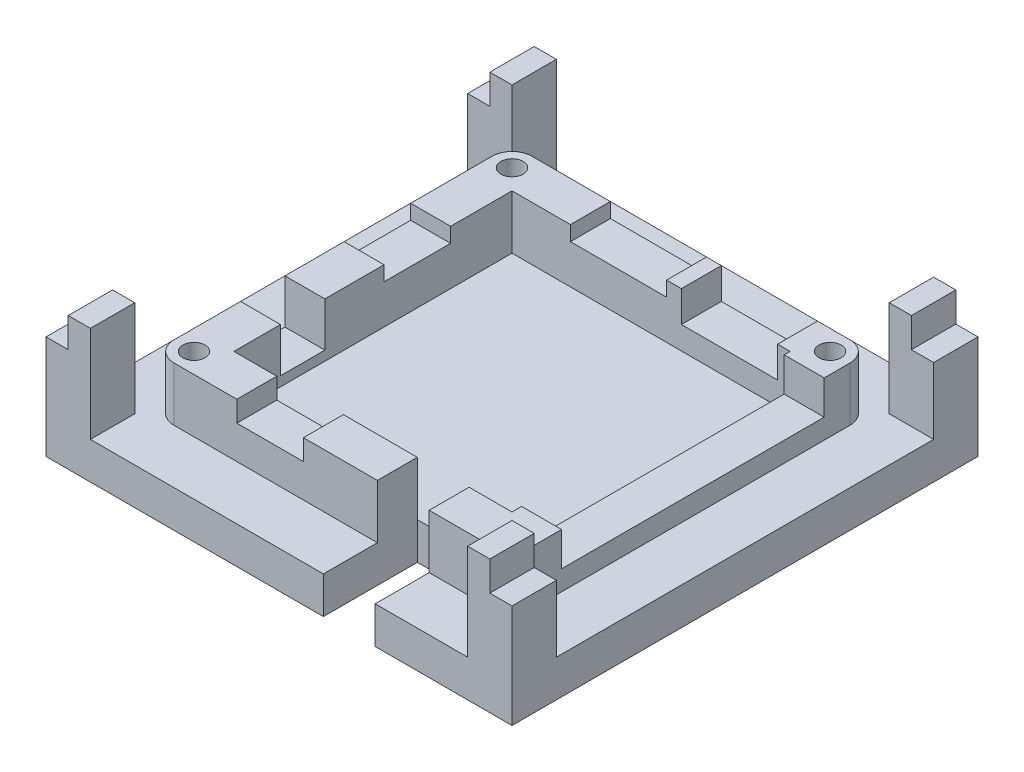
from build123d import *

# Parameters (mm, degrees)
SKETCH1_W           = 63
SKETCH1_H           = 63
BOSS_EXTRUDE1_DEPTH = 5
SKETCH2_W           = 6
SKETCH2_H           = 6
BOSS_EXTRUDE2_DEPTH = 13
SKETCH3_R           = 1.5
CUT_EXTRUDE1_DEPTH  = 5
BOSS_EXTRUDE3_START = 7.3
SKETCH4_R           = 2.7
SKETCH4_R_2         = 1.5
BOSS_EXTRUDE3_DEPTH = 7.3
BOSS_EXTRUDE4_START = 7.3
BOSS_EXTRUDE4_DEPTH = 7.3
SKETCH6_W           = 9
SKETCH6_H           = 5.4
CUT_EXTRUDE2_DEPTH  = 2.8
CUT_EXTRUDE3_REACH  = 91.94
SKETCH7_W           = 7
SKETCH7_H           = 12.7
BOSS_EXTRUDE5_START = 7.3
BOSS_EXTRUDE5_DEPTH = 7.3
SKETCH9_W           = 5.4
SKETCH9_H           = 35.5
CUT_EXTRUDE4_DEPTH  = 4.6
SKETCH10_W          = 13
SKETCH10_H          = 5.4
CUT_EXTRUDE5_DEPTH  = 4.2
SKETCH11_W          = 13
SKETCH11_H          = 5.4
CUT_EXTRUDE6_DEPTH  = 2
SKETCH12_W          = 5.4
SKETCH12_H          = 9
CUT_EXTRUDE7_DEPTH  = 2
SKETCH13_W          = 5.4
SKETCH13_H          = 6
CUT_EXTRUDE8_DEPTH  = 6
SKETCH14_W          = 3
SKETCH14_H          = 6
CUT_EXTRUDE9_DEPTH  = 4


with BuildPart() as part:
    # Sketch1 → Boss-Extrude1 (new body)
    with BuildSketch(Plane(origin=(0, 0, 0), x_dir=(1, 0, 0), z_dir=(0, 1, 0))):
        with Locations((31.5, 31.5)):
            Rectangle(SKETCH1_W, SKETCH1_H)
    extrude(amount=BOSS_EXTRUDE1_DEPTH)

    # Sketch2 → Boss-Extrude2 (add)
    with BuildSketch(Plane(origin=(0, 5, 0), x_dir=(1, 0, 0), z_dir=(0, 1, 0))):
        with Locations((3, 60)):
            Rectangle(SKETCH2_W, SKETCH2_H)
        with Locations((3, 3)):
            Rectangle(SKETCH2_W, SKETCH2_H)
        with Locations((60, 60)):
            Rectangle(SKETCH2_W, SKETCH2_H)
        with Locations((60, 3)):
            Rectangle(SKETCH2_W, SKETCH2_H)
    extrude(amount=BOSS_EXTRUDE2_DEPTH)

    # Sketch3 → Cut-Extrude1 (cut)
    with BuildSketch(Plane(origin=(0, 5, 0), x_dir=(1, 0, 0), z_dir=(0, 1, 0))):
        with Locations(Location((53, 10, 0), (0, 0, 270))):
            Circle(SKETCH3_R)
        with Locations(Location((10, 10, 0), (0, 0, 270))):
            Circle(SKETCH3_R)
        with Locations(Location((10, 53, 0), (0, 0, 270))):
            Circle(SKETCH3_R)
        with Locations(Location((53, 53, 0), (0, 0, 270))):
            Circle(SKETCH3_R)
    extrude(amount=-CUT_EXTRUDE1_DEPTH, mode=Mode.SUBTRACT)

    # Sketch4 → Boss-Extrude3 (add)
    # profile 1 of 4: a face of its own
    with BuildSketch(Plane(origin=(0, 5, 0), x_dir=(1, 0, 0), z_dir=(0, 1, 0)).offset(BOSS_EXTRUDE3_START)):
        with Locations(Location((10, 10, 0), (0, 0, 90))):
            Circle(SKETCH4_R)
        with Locations(Location((10, 10, 0), (0, 0, 270))):
            Circle(SKETCH4_R_2, mode=Mode.SUBTRACT)
    # profile 2 of 4: a face of its own
    with BuildSketch(Plane(origin=(0, 5, 0), x_dir=(1, 0, 0), z_dir=(0, 1, 0)).offset(BOSS_EXTRUDE3_START)):
        with Locations(Location((10, 53, 0), (0, 0, 90))):
            Circle(SKETCH4_R)
        with Locations(Location((10, 53, 0), (0, 0, 270))):
            Circle(SKETCH4_R_2, mode=Mode.SUBTRACT)
    # profile 3 of 4: a face of its own
    with BuildSketch(Plane(origin=(0, 5, 0), x_dir=(1, 0, 0), z_dir=(0, 1, 0)).offset(BOSS_EXTRUDE3_START)):
        with Locations(Location((53, 10, 0), (0, 0, 90))):
            Circle(SKETCH4_R)
        with Locations(Location((53, 10, 0), (0, 0, 270))):
            Circle(SKETCH4_R_2, mode=Mode.SUBTRACT)
    # profile 4 of 4: a face of its own
    with BuildSketch(Plane(origin=(0, 5, 0), x_dir=(1, 0, 0), z_dir=(0, 1, 0)).offset(BOSS_EXTRUDE3_START)):
        with Locations(Location((53, 53, 0), (0, 0, 90))):
            Circle(SKETCH4_R)
        with Locations(Location((53, 53, 0), (0, 0, 270))):
            Circle(SKETCH4_R_2, mode=Mode.SUBTRACT)
    extrude(amount=-BOSS_EXTRUDE3_DEPTH)

    # Sketch5 → Boss-Extrude4 (add)
    with BuildSketch(Plane(origin=(0, 5, 0), x_dir=(1, 0, 0), z_dir=(0, 1, 0)).offset(BOSS_EXTRUDE4_START)):
        with BuildLine():
            Line((10, 7.3), (53, 7.3))
            ThreePointArc((53, 7.3), (50.3, 10), (53, 12.7))
            Line((53, 12.7), (10, 12.7))
            ThreePointArc((10, 12.7), (12.7, 10), (10, 7.3))
        make_face()
    extrude(amount=-BOSS_EXTRUDE4_DEPTH)

    # Sketch6 → Cut-Extrude2 (cut)
    with BuildSketch(Plane(origin=(0, 12.3, 0), x_dir=(1, 0, 0), z_dir=(0, 1, 0))):
        with Locations((23, 10)):
            Rectangle(SKETCH6_W, SKETCH6_H)
    extrude(amount=-CUT_EXTRUDE2_DEPTH, mode=Mode.SUBTRACT)

    # Cut-Extrude3: up to this face of the body (flat: up to its plane)
    cut_extrude3_end = Plane(part.part.faces().sort_by_distance((31.5, 0, -31.5))[0])
    # Sketch7 → Cut-Extrude3 (cut, up to the picked face)
    with BuildSketch(Plane(origin=(0, 12.3, 0), x_dir=(1, 0, 0), z_dir=(0, 1, 0)), mode=Mode.PRIVATE) as cut_extrude3_sk1:
        with Locations((41, 6.35)):
            Rectangle(SKETCH7_W, SKETCH7_H)
    cut_extrude3_tool1 = split(extrude(cut_extrude3_sk1.sketch, amount=-CUT_EXTRUDE3_REACH, mode=Mode.PRIVATE), bisect_by=cut_extrude3_end, keep=Keep.BOTH, mode=Mode.PRIVATE)
    add(cut_extrude3_tool1.solids().sort_by(Axis((41, 12.3, -6.35), (0, -1, 0)))[0], mode=Mode.SUBTRACT)

    # Sketch8 → Boss-Extrude5 (add)
    with BuildSketch(Plane(origin=(0, 5, 0), x_dir=(1, 0, 0), z_dir=(0, 1, 0)).offset(BOSS_EXTRUDE5_START)):
        with BuildLine():
            Line((55.7, 53), (55.7, 10))
            ThreePointArc((55.7, 10), (54.909188309, 11.909188309), (53, 12.7))
            Line((53, 12.7), (50.3, 12.7))
            Line((50.3, 12.7), (50.3, 50.3))
            Line((50.3, 50.3), (12.7, 50.3))
            Line((12.7, 50.3), (12.7, 12.7))
            Line((12.7, 12.7), (10, 12.7))
            ThreePointArc((10, 12.7), (8.090811691, 11.909188309), (7.3, 10))
            Line((7.3, 10), (7.3, 53))
            ThreePointArc((7.3, 53), (8.090811691, 51.090811691), (10, 50.3))
            ThreePointArc((10, 50.3), (12.7, 53), (10, 55.7))
            Line((10, 55.7), (53, 55.7))
            ThreePointArc((53, 55.7), (51.090811691, 54.909188309), (50.3, 53))
            ThreePointArc((50.3, 53), (53, 50.3), (55.7, 53))
        make_face()
    extrude(amount=-BOSS_EXTRUDE5_DEPTH)

    # Sketch9 → Cut-Extrude4 (cut)
    with BuildSketch(Plane(origin=(0, 12.3, 0), x_dir=(1, 0, 0), z_dir=(0, 1, 0))):
        with Locations((53, 31.75)):
            Rectangle(SKETCH9_W, SKETCH9_H)
    extrude(amount=-CUT_EXTRUDE4_DEPTH, mode=Mode.SUBTRACT)

    # Sketch10 → Cut-Extrude5 (cut)
    with BuildSketch(Plane(origin=(0, 12.3, 0), x_dir=(1, 0, 0), z_dir=(0, 1, 0))):
        with Locations((42.1, 53)):
            Rectangle(SKETCH10_W, SKETCH10_H)
    extrude(amount=-CUT_EXTRUDE5_DEPTH, mode=Mode.SUBTRACT)

    # Sketch11 → Cut-Extrude6 (cut)
    with BuildSketch(Plane(origin=(0, 12.3, 0), x_dir=(1, 0, 0), z_dir=(0, 1, 0))):
        with Locations((27.1, 53)):
            Rectangle(SKETCH11_W, SKETCH11_H)
    extrude(amount=-CUT_EXTRUDE6_DEPTH, mode=Mode.SUBTRACT)

    # Sketch12 → Cut-Extrude7 (cut)
    with BuildSketch(Plane(origin=(0, 12.3, 0), x_dir=(1, 0, 0), z_dir=(0, 1, 0))):
        with Locations((10, 37.5)):
            Rectangle(SKETCH12_W, SKETCH12_H)
    extrude(amount=-CUT_EXTRUDE7_DEPTH, mode=Mode.SUBTRACT)

    # Sketch13 → Cut-Extrude8 (cut)
    with BuildSketch(Plane(origin=(0, 12.3, 0), x_dir=(1, 0, 0), z_dir=(0, 1, 0))):
        with Locations((10, 22)):
            Rectangle(SKETCH13_W, SKETCH13_H)
    extrude(amount=-CUT_EXTRUDE8_DEPTH, mode=Mode.SUBTRACT)

    # Sketch14 → Cut-Extrude9 (cut)
    with BuildSketch(Plane(origin=(0, 18, 0), x_dir=(1, 0, 0), z_dir=(0, 1, 0))):
        with Locations((1.5, 3)):
            Rectangle(SKETCH14_W, SKETCH14_H)
        with Locations((61.5, 3)):
            Rectangle(SKETCH14_W, SKETCH14_H)
        with Locations((61.5, 60)):
            Rectangle(SKETCH14_W, SKETCH14_H)
        with Locations((1.5, 60)):
            Rectangle(SKETCH14_W, SKETCH14_H)
    extrude(amount=-CUT_EXTRUDE9_DEPTH, mode=Mode.SUBTRACT)


solid = part.part
